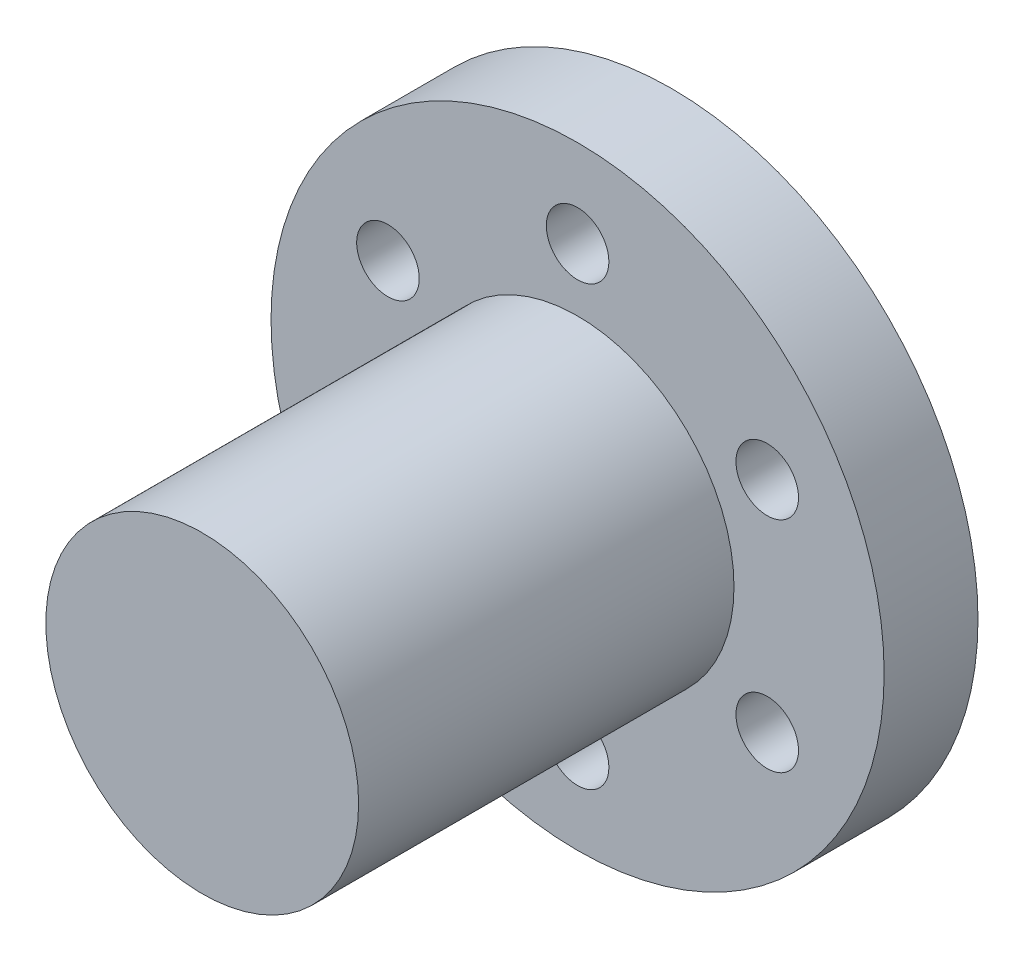
from build123d import *

# Parameters (mm, degrees)
SKETCH1_R           = 1244.6
BOSS_EXTRUDE1_DEPTH = 190.5
SKETCH2_R           = 127
CUT_EXTRUDE1_DEPTH  = 1801.894033529
SKETCH3_R           = 635
BOSS_EXTRUDE2_DEPTH = 1524


with BuildPart() as part:
    # Sketch1 → Boss-Extrude1 (new, symmetric)
    with BuildSketch(Plane.XY):
        Circle(SKETCH1_R)
    extrude(amount=BOSS_EXTRUDE1_DEPTH, both=True)

    # Sketch2 → Cut-Extrude1 (cut, through all)
    with BuildSketch(Plane.XY.offset(190.5)):
        with Locations((0, 889)):
            Circle(SKETCH2_R)
        with Locations((769.896583964, 444.5)):
            Circle(SKETCH2_R)
        with Locations((769.896583964, -444.5)):
            Circle(SKETCH2_R)
        with Locations((0, -889)):
            Circle(SKETCH2_R)
        with Locations((-769.896583964, -444.5)):
            Circle(SKETCH2_R)
        with Locations((-769.896583964, 444.5)):
            Circle(SKETCH2_R)
    extrude(amount=-CUT_EXTRUDE1_DEPTH, mode=Mode.SUBTRACT)

    # Sketch3 → Boss-Extrude2 (add)
    with BuildSketch(Plane.XY.offset(190.5)):
        Circle(SKETCH3_R)
    extrude(amount=BOSS_EXTRUDE2_DEPTH)


solid = part.part
